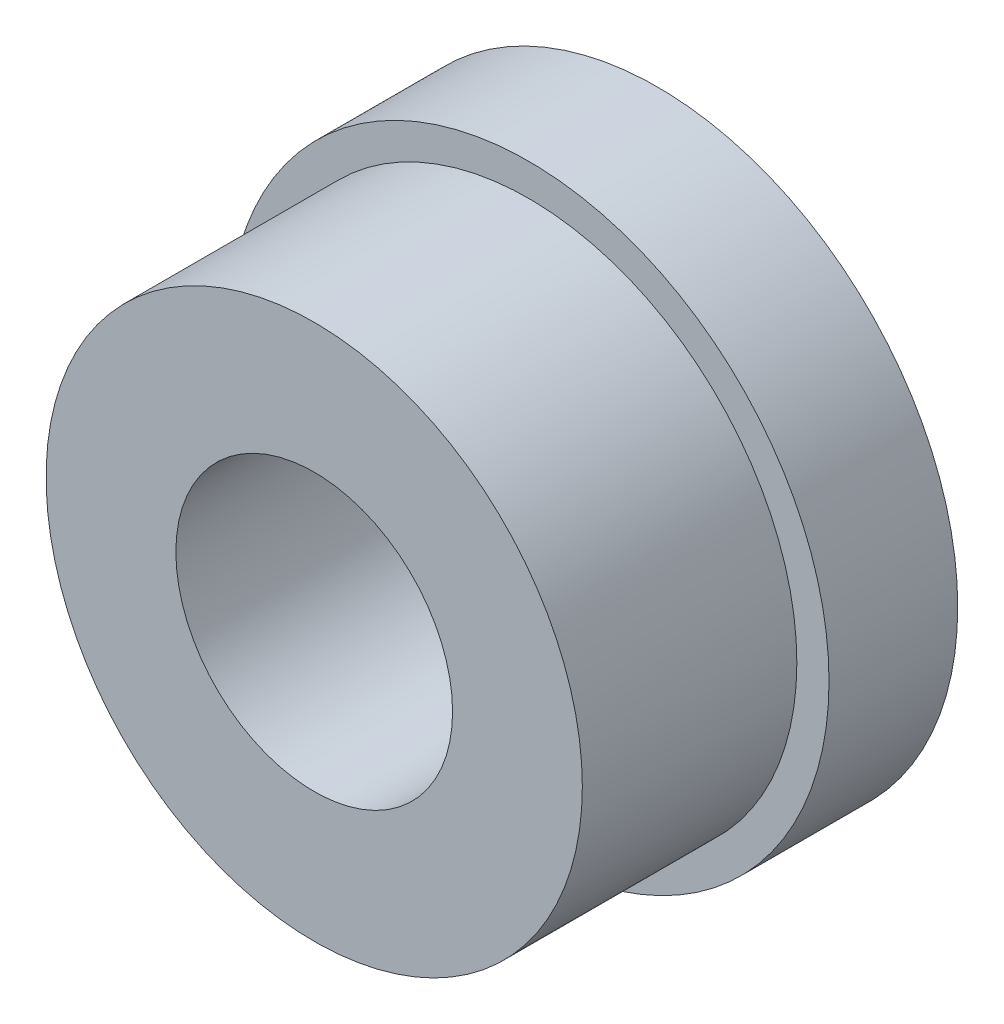
from build123d import *
from build123d.topology import SkipClean

# Parameters (mm, degrees)
SKETCH_1_R      = 12.5
SKETCH_1_R_2    = 6.45
EXTRUDE_1_DEPTH = 10
EXTRUDE_START   = 6
SKETCH_2_R      = 14
SKETCH_2_R_2    = 6.45
EXTRUDE_2_DEPTH = 6


with BuildPart() as part:
    # 草图1 → 凸台-拉伸1 (new body)
    with BuildSketch(Plane.XY):
        Circle(SKETCH_1_R)
        Circle(SKETCH_1_R_2, mode=Mode.SUBTRACT)
    extrude(amount=EXTRUDE_1_DEPTH)

    # 草图2 → 凸台-拉伸2 (add)
    with SkipClean():  # the faces are left unmerged after this step: merging them gives an invalid solid
        with BuildSketch(Plane(origin=(0, 0, 0), x_dir=(-1, 0, 0), z_dir=(0, 0, -1)).offset(EXTRUDE_START)):
            Circle(SKETCH_2_R)
            Circle(SKETCH_2_R_2, mode=Mode.SUBTRACT)
        extrude(amount=-EXTRUDE_2_DEPTH)


solid = part.part
